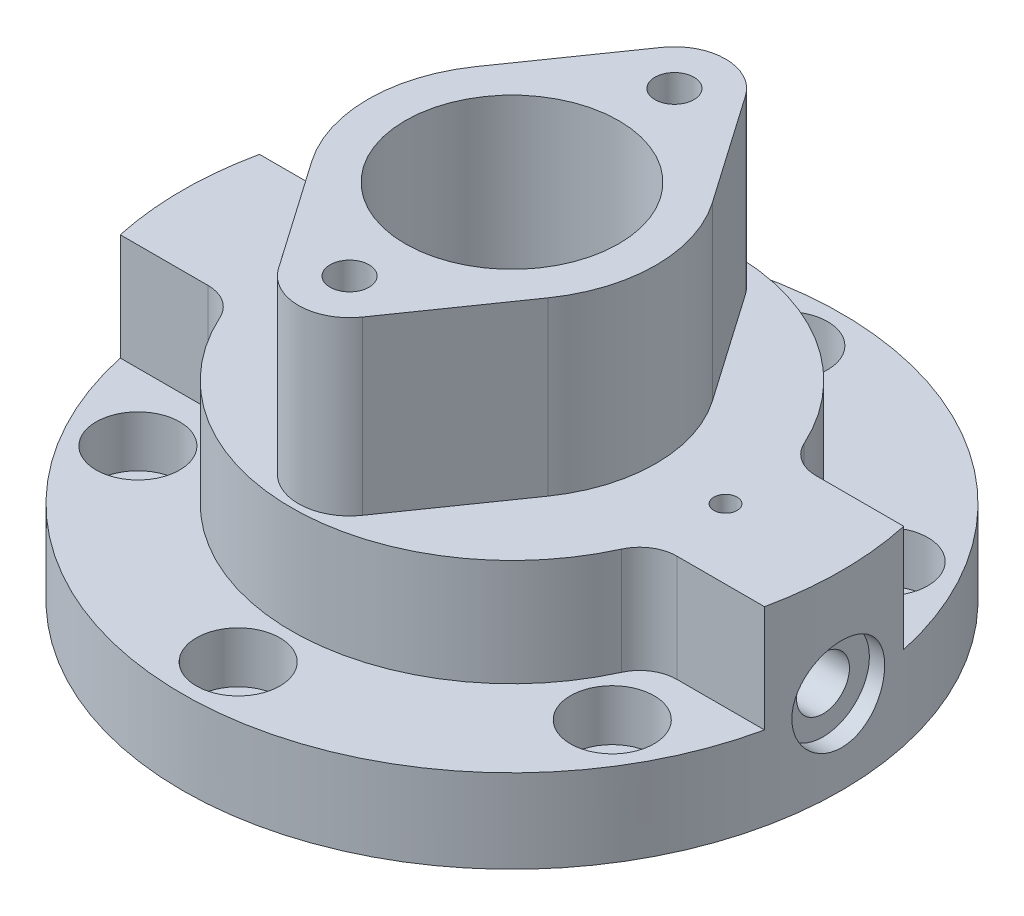
from build123d import *

# Parameters (mm, degrees)
SKETCH_1_R                   = 35.5
SKETCH_1_R_2                 = 2.75
EXTRUDE_1_DEPTH              = 9
SKETCH_2_R                   = 4.5
CUT_EXTRUDE_1_DEPTH          = 5.5
EXTRUDE_2_DEPTH              = 11.5
FILLET_1_R                   = 4
EXTRUDE_3_DEPTH              = 18.5
HOLE_WIZARD_M5_1_D           = 4.2
HOLE_WIZARD_M5_1_DEPTH       = 7.5
HOLE_WIZARD_M5_1_TIP         = 1.2618073
CUT_EXTRUDE_3_DEPTH          = 64.572792923
CUT_EXTRUDE_3_DEPTH_BACK     = 64.572792923
SKETCH_13_R                  = 2.85
SKETCH_14_R                  = 5
CUT_EXTRUDE_4_DEPTH          = 87.846128416
SKETCH_15_R                  = 5
CUT_EXTRUDE_5_DEPTH          = 87.846128416
HOLE_WIZARD_2_5_2_5_1_REACH  = 56.229
HOLE_WIZARD_2_5_2_5_1_BORE_R = 1.25
SKETCH_19_R                  = 12.5
CUT_EXTRUDE_6_DEPTH          = 7
CUT_EXTRUDE_6_DRAFT          = -15
SKETCH_20_R                  = 15.5
CUT_EXTRUDE_7_DEPTH          = 9
FILLET_2_R                   = 2


with BuildPart() as part:
    # 스케치1 → 보스-돌출1 (new body)
    with BuildSketch(Plane(origin=(0, 0, 0), x_dir=(1, 0, 0), z_dir=(0, 1, 0))):
        with Locations(Location((0, 0, 0), (0, 0, 270))):
            Circle(SKETCH_1_R)
        with Locations(Location((0, 29.5, 0), (0, 0, 270))):
            Circle(SKETCH_1_R_2, mode=Mode.SUBTRACT)
        with Locations(Location((25.547749412, 14.75, 0), (0, 0, 270))):
            Circle(SKETCH_1_R_2, mode=Mode.SUBTRACT)
        with Locations(Location((25.547749412, -14.75, 0), (0, 0, 270))):
            Circle(SKETCH_1_R_2, mode=Mode.SUBTRACT)
        with Locations(Location((0, -29.5, 0), (0, 0, 270))):
            Circle(SKETCH_1_R_2, mode=Mode.SUBTRACT)
        with Locations(Location((-25.547749412, -14.75, 0), (0, 0, 270))):
            Circle(SKETCH_1_R_2, mode=Mode.SUBTRACT)
        with Locations(Location((-25.547749412, 14.75, 0), (0, 0, 270))):
            Circle(SKETCH_1_R_2, mode=Mode.SUBTRACT)
    extrude(amount=EXTRUDE_1_DEPTH)

    # 스케치2 → 컷-돌출1 (cut)
    with BuildSketch(Plane(origin=(0, 9, 0), x_dir=(1, 0, 0), z_dir=(0, 1, 0))):
        with Locations(Location((0, 29.5, 0), (0, 0, 270))):
            Circle(SKETCH_2_R)
        with Locations(Location((25.548249412, 14.750866025, 0), (0, 0, 270))):
            Circle(SKETCH_2_R)
        with Locations(Location((25.549249412, -14.749133975, 0), (0, 0, 270))):
            Circle(SKETCH_2_R)
        with Locations(Location((0.002, -29.5, 0), (0, 0, 270))):
            Circle(SKETCH_2_R)
        with Locations(Location((-25.546249412, -14.750866025, 0), (0, 0, 270))):
            Circle(SKETCH_2_R)
        with Locations(Location((-25.547249412, 14.749133975, 0), (0, 0, 270))):
            Circle(SKETCH_2_R)
    extrude(amount=-CUT_EXTRUDE_1_DEPTH, mode=Mode.SUBTRACT)

    # 스케치3 → 보스-돌출2 (add)
    with BuildSketch(Plane(origin=(0, 9, 0), x_dir=(1, 0, 0), z_dir=(0, 1, 0))):
        with BuildLine():
            ThreePointArc((35.5, 0), (35.299107366, 3.771341825), (34.698703146, 7.5))
            Line((34.698703146, 7.5), (22.534695472, 7.5))
            ThreePointArc((22.534695472, 7.5), (0, 23.75), (-22.534695472, 7.5))
            Line((-22.534695472, 7.5), (-34.698703146, 7.5))
            ThreePointArc((-34.698703146, 7.5), (-35.5, 0), (-34.698703146, -7.5))
            Line((-34.698703146, -7.5), (-22.534695472, -7.5))
            ThreePointArc((-22.534695472, -7.5), (0, -23.75), (22.534695472, -7.5))
            Line((22.534695472, -7.5), (34.698703146, -7.5))
            ThreePointArc((34.698703146, -7.5), (35.299107366, -3.771341825), (35.5, 0))
        make_face()
    extrude(amount=EXTRUDE_2_DEPTH)

    # 필렛1
    fillet_1_edges = [part.edges().sort_by_distance(p)[0] for p in [
        (22.534695472, 14.75, -7.5),
        (-22.534695472, 14.75, -7.5),
        (-22.534695472, 14.75, 7.5),
        (22.534695472, 14.75, 7.5),
    ]]
    fillet(fillet_1_edges, radius=FILLET_1_R)

    # 스케치8 → 보스-돌출3 (add)
    with BuildSketch(Plane(origin=(0, 20.5, 0), x_dir=(1, 0, 0), z_dir=(0, 1, 0))):
        with BuildLine():
            Line((-4.513584937, 20.642857143), (-12.720103003, 8.857142857))
            ThreePointArc((-12.720103003, 8.857142857), (-15.5, 0), (-12.720103003, -8.857142857))
            Line((-12.720103003, -8.857142857), (-4.513584937, -20.642857143))
            ThreePointArc((-4.513584937, -20.642857143), (0, -23), (4.513584937, -20.642857143))
            Line((4.513584937, -20.642857143), (12.720103003, -8.857142857))
            ThreePointArc((12.720103003, -8.857142857), (15.5, 0), (12.720103003, 8.857142857))
            Line((12.720103003, 8.857142857), (4.513584937, 20.642857143))
            ThreePointArc((4.513584937, 20.642857143), (0, 23), (-4.513584937, 20.642857143))
        make_face()
    extrude(amount=EXTRUDE_3_DEPTH)

    # M5 나사 구멍1
    with Locations(Plane(origin=(0, 39, 0), x_dir=(1, 0, 0), z_dir=(0, 1, 0))):
        with Locations((0, 17.5), (0, -17.5)):
            Hole(HOLE_WIZARD_M5_1_D / 2, depth=HOLE_WIZARD_M5_1_DEPTH)
            with Locations((0, 0, -(HOLE_WIZARD_M5_1_DEPTH + HOLE_WIZARD_M5_1_TIP / 2))):  # 118° drill point
                Cone(0, HOLE_WIZARD_M5_1_D / 2, HOLE_WIZARD_M5_1_TIP, mode=Mode.SUBTRACT)

    # 스케치13 → 컷-돌출3 (cut, two sides: drawn at the far end of the back side and taken through both)
    with BuildSketch(Plane(origin=(0, 0, 0), x_dir=(0, 0, -1), z_dir=(1, 0, 0)).offset(-CUT_EXTRUDE_3_DEPTH_BACK)):
        with Locations((0, 9)):
            Circle(SKETCH_13_R)
    extrude(amount=CUT_EXTRUDE_3_DEPTH + CUT_EXTRUDE_3_DEPTH_BACK, mode=Mode.SUBTRACT)

    # 스케치14 → 컷-돌출4 (cut, through all)
    with BuildSketch(Plane(origin=(33.5, 0, 0), x_dir=(0, 0, -1), z_dir=(1, 0, 0))):
        with Locations(Location((0, 9, 0), (0, 0, 270))):
            Circle(SKETCH_14_R)
    extrude(amount=CUT_EXTRUDE_4_DEPTH, mode=Mode.SUBTRACT)

    # 스케치15 → 컷-돌출5 (cut, through all)
    with BuildSketch(Plane(origin=(-33.5, 0, 0), x_dir=(0, 0, -1), z_dir=(1, 0, 0))):
        with Locations(Location((0, 9, 0), (0, 0, 270))):
            Circle(SKETCH_15_R)
    extrude(amount=-CUT_EXTRUDE_5_DEPTH, mode=Mode.SUBTRACT)

    # Ø2.5 (2.5) 지름 구멍1 bore → Ø2.5 (2.5) 지름 구멍1 (cut, up to next)
    with BuildSketch(Plane(origin=(0, 20.5, 0), x_dir=(1, 0, 0), z_dir=(0, 1, 0)), mode=Mode.PRIVATE) as hole_wizard_2_5_2_5_1_sk1:
        with Locations((23, 0)):
            Circle(HOLE_WIZARD_2_5_2_5_1_BORE_R)
    hole_wizard_2_5_2_5_1_tool1 = extrude(hole_wizard_2_5_2_5_1_sk1.sketch, amount=-HOLE_WIZARD_2_5_2_5_1_REACH, mode=Mode.PRIVATE) & part.part
    # Ø2.5 (2.5) 지름 구멍1 bore → Ø2.5 (2.5) 지름 구멍1 (cut, up to next)
    with BuildSketch(Plane(origin=(0, 20.5, 0), x_dir=(1, 0, 0), z_dir=(0, 1, 0)), mode=Mode.PRIVATE) as hole_wizard_2_5_2_5_1_sk2:
        with Locations((-23, 0)):
            Circle(HOLE_WIZARD_2_5_2_5_1_BORE_R)
    hole_wizard_2_5_2_5_1_tool2 = extrude(hole_wizard_2_5_2_5_1_sk2.sketch, amount=-HOLE_WIZARD_2_5_2_5_1_REACH, mode=Mode.PRIVATE) & part.part
    add(hole_wizard_2_5_2_5_1_tool1.solids().sort_by_distance((23, 20.5, 0))[0], mode=Mode.SUBTRACT)
    add(hole_wizard_2_5_2_5_1_tool2.solids().sort_by_distance((-23, 20.5, 0))[0], mode=Mode.SUBTRACT)

    # 스케치10 → 컷-회전1 (revolve, cut)
    with BuildSketch(Plane.XY, mode=Mode.PRIVATE) as cut_revolve_1_sk:
        Polygon((11.5, 39), (11.5, 20.5), (7.5, 20.5), (7.5, 0), (0, 0), (0, 39), align=None)
    revolve(cut_revolve_1_sk.sketch.rotate(Axis((0, 0, 0), (0, 1, 0)), 90), axis=Axis((0, 0, 0), (0, 1, 0)), mode=Mode.SUBTRACT)


with BuildPart() as cut_extrude_6_tool:
    # 스케치19 → 컷-돌출6 (with draft: the straight prism first)
    with BuildSketch(Plane(origin=(0, 9, 0), x_dir=(-1, 0, 0), z_dir=(0, -1, 0))):
        Circle(SKETCH_19_R)
    extrude(amount=-CUT_EXTRUDE_6_DEPTH)
    # 컷-돌출6: the draft: its side faces are tilted about the plane it starts from
    cut_extrude_6_sides = [cut_extrude_6_tool.faces().sort_by_distance(p)[0] for p in [
        (12.5, 12.5, 0),
    ]]
    draft(cut_extrude_6_sides, Plane(origin=(0, 9, 0), x_dir=(-1, 0, 0), z_dir=(0, -1, 0)), CUT_EXTRUDE_6_DRAFT)


with BuildPart() as part_1:
    add(part.part)

    # 컷-돌출6: cut by cut_extrude_6_tool
    add(cut_extrude_6_tool.part, mode=Mode.SUBTRACT)

    # 스케치20 → 컷-돌출7 (cut)
    with BuildSketch(Plane.XZ):
        with Locations(Location((0, 0, 0), (0, 0, 270))):
            Circle(SKETCH_20_R)
    extrude(amount=-CUT_EXTRUDE_7_DEPTH, mode=Mode.SUBTRACT)

    # 필렛2
    fillet_2_edges = [part_1.edges().sort_by_distance(p)[0] for p in [
        (10.624355653, 16, 0),
    ]]
    fillet(fillet_2_edges, radius=FILLET_2_R)


solid = part_1.part
